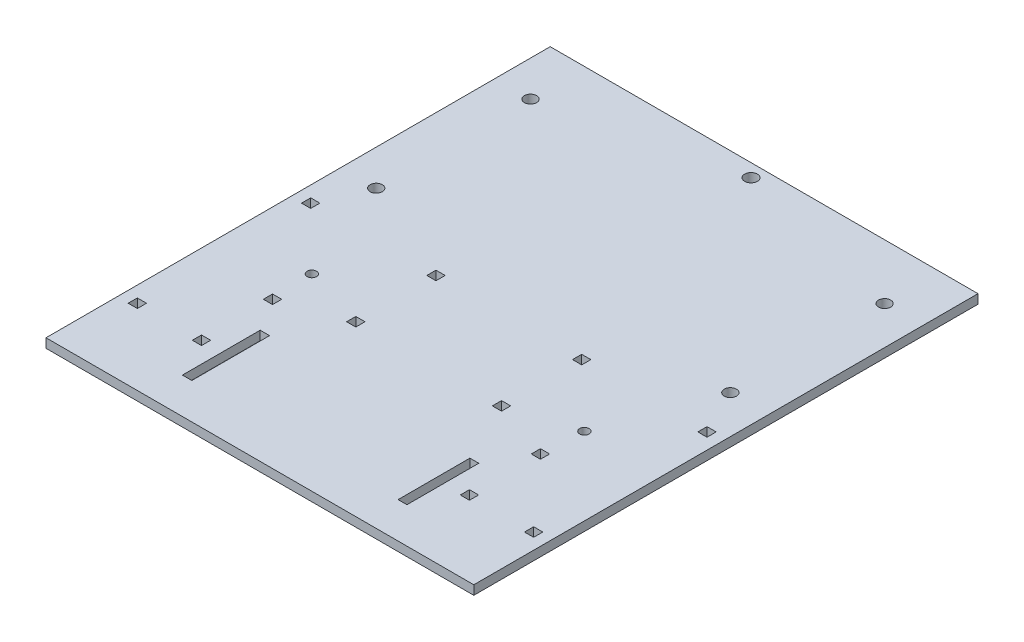
from build123d import *

# Parameters (mm, degrees)
SKETCH1_W           = 140
SKETCH1_H           = 165
SKETCH1_R           = 2.075495439
SKETCH1_R_2         = 1.55
SKETCH1_R_3         = 1.99999854
SKETCH1_W_2         = 3
SKETCH1_H_2         = 3
SKETCH1_W_3         = 3.071243945
SKETCH1_H_3         = 25.44744983
SKETCH1_W_4         = 2.90164108
SKETCH1_H_4         = 23.501913203
BOSS_EXTRUDE1_DEPTH = 3


with BuildPart() as part:
    # Sketch1 → Boss-Extrude1 (new body)
    with BuildSketch(Plane(origin=(0, 0, 0), x_dir=(1, 0, 0), z_dir=(0, 1, 0))):
        Rectangle(SKETCH1_W, SKETCH1_H)
        with Locations(Location((0, 78.220695367, 0), (0, 0, 270))):
            Circle(SKETCH1_R, mode=Mode.SUBTRACT)
        with Locations(Location((-44.593659723, -20.900034899, 0), (0, 0, 270))):
            Circle(SKETCH1_R_2, mode=Mode.SUBTRACT)
        with Locations(Location((44.593659723, -20.900034899, 0), (0, 0, 270))):
            Circle(SKETCH1_R_2, mode=Mode.SUBTRACT)
        with Locations(Location((-58.3565, 13.925245662, 0), (0, 0, 270))):
            Circle(SKETCH1_R_3, mode=Mode.SUBTRACT)
        with Locations(Location((-58.3565, 64.407745662, 0), (0, 0, 270))):
            Circle(SKETCH1_R_3, mode=Mode.SUBTRACT)
        with Locations(Location((57.531, 64.407745662, 0), (0, 0, 270))):
            Circle(SKETCH1_R_3, mode=Mode.SUBTRACT)
        with Locations(Location((57.531, 13.925245662, 0), (0, 0, 270))):
            Circle(SKETCH1_R_3, mode=Mode.SUBTRACT)
        with Locations((-23.843659723, -1.031919399)):
            Rectangle(SKETCH1_W_2, SKETCH1_H_2, mode=Mode.SUBTRACT)
        with Locations((-64.843659723, -1.031884133)):
            Rectangle(SKETCH1_W_2, SKETCH1_H_2, mode=Mode.SUBTRACT)
        with Locations((-64.843659723, -57.768115133)):
            Rectangle(SKETCH1_W_2, SKETCH1_H_2, mode=Mode.SUBTRACT)
        with Locations((-43.843659723, -57.768150399)):
            Rectangle(SKETCH1_W_2, SKETCH1_H_2, mode=Mode.SUBTRACT)
        with Locations((-43.843659723, -34.531919899)):
            Rectangle(SKETCH1_W_2, SKETCH1_H_2, mode=Mode.SUBTRACT)
        with Locations((-23.843659723, -27.268149899)):
            Rectangle(SKETCH1_W_2, SKETCH1_H_2, mode=Mode.SUBTRACT)
        with Locations((43.843659723, -34.531919899)):
            Rectangle(SKETCH1_W_2, SKETCH1_H_2, mode=Mode.SUBTRACT)
        with Locations((23.843659723, -27.268149899)):
            Rectangle(SKETCH1_W_2, SKETCH1_H_2, mode=Mode.SUBTRACT)
        with Locations((43.843659723, -57.768150399)):
            Rectangle(SKETCH1_W_2, SKETCH1_H_2, mode=Mode.SUBTRACT)
        with Locations((64.843659723, -57.768115133)):
            Rectangle(SKETCH1_W_2, SKETCH1_H_2, mode=Mode.SUBTRACT)
        with Locations((64.843659723, -1.031884133)):
            Rectangle(SKETCH1_W_2, SKETCH1_H_2, mode=Mode.SUBTRACT)
        with Locations((23.843659723, -1.031919399)):
            Rectangle(SKETCH1_W_2, SKETCH1_H_2, mode=Mode.SUBTRACT)
        with Locations((-35.561590823, -58.032613537)):
            Rectangle(SKETCH1_W_3, SKETCH1_H_3, mode=Mode.SUBTRACT)
        with Locations((34.92934681, -59.005381851)):
            Rectangle(SKETCH1_W_4, SKETCH1_H_4, mode=Mode.SUBTRACT)
    extrude(amount=BOSS_EXTRUDE1_DEPTH)


solid = part.part
